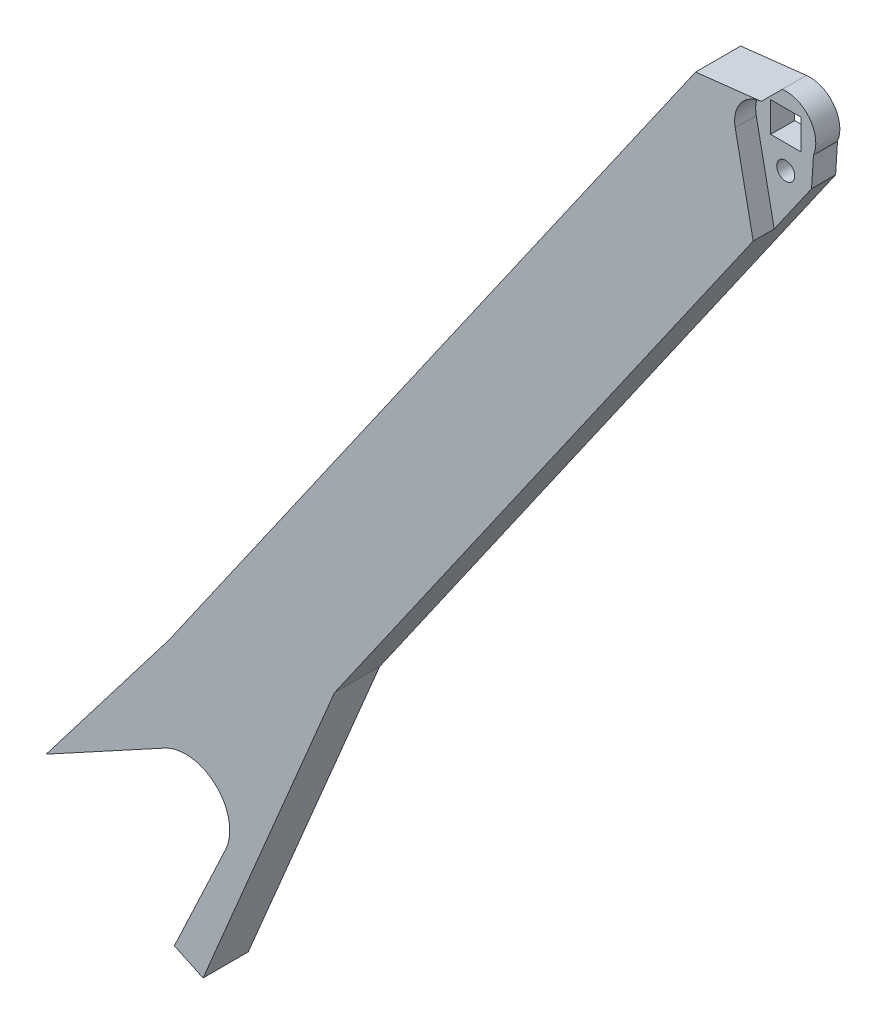
from build123d import *

# Parameters (mm, degrees)
BOSS_EXTRUDE1_DEPTH = 9.525
CUT_EXTRUDE1_START  = -4.445
CUT_EXTRUDE1_DEPTH  = 4.445
SKETCH3_R           = 1.905
SKETCH3_W           = 6.35
SKETCH3_H           = 6.35
CUT_EXTRUDE2_DEPTH  = 252.056346263


with BuildPart() as part:
    # Sketch1 → Boss-Extrude1 (new body)
    with BuildSketch(Plane.XY):
        with BuildLine():
            Line((37.887154169, 1.47019733), (27.071909447, -21.512197706))
            Line((27.071909447, -21.512197706), (33.138342598, -24.366989778))
            Line((33.138342598, -24.366989778), (60.90777145, 41.722489626))
            Line((60.90777145, 41.722489626), (157.204972785, 179.808197732))
            Line((157.204972785, 179.808197732), (157.605048009, 186.145582036))
            ThreePointArc((157.605048009, 186.145582036), (156.833701368, 192.411577396), (151.038083589, 194.915272276))
            Line((151.038083589, 194.915272276), (137.156365398, 193.347216127))
            Line((137.156365398, 193.347216127), (25.899136681, 33.809524518))
            Line((25.899136681, 33.809524518), (0, 0))
            Line((0, 0), (25.00366663, 13.61700957))
            ThreePointArc((25.00366663, 13.61700957), (35.848848557, 12.214099668), (37.887154169, 1.47019733))
        make_face()
    extrude(amount=BOSS_EXTRUDE1_DEPTH)

    # Sketch2 → Cut-Extrude1 (cut)
    with BuildSketch(Plane.XY.offset(9.525).offset(CUT_EXTRUDE1_START)):
        with BuildLine():
            Line((149.320840168, 168.502718236), (145.525755772, 187.35205629))
            ThreePointArc((145.525755772, 187.35205629), (146.619175628, 192.34552843), (151.038083589, 194.915272276))
            ThreePointArc((151.038083589, 194.915272276), (156.833701368, 192.411577396), (157.605048009, 186.145582036))
            Line((157.605048009, 186.145582036), (157.204972785, 179.808197732))
            Line((157.204972785, 179.808197732), (149.320840168, 168.502718236))
        make_face()
    extrude(amount=CUT_EXTRUDE1_DEPTH, mode=Mode.SUBTRACT)

    # Sketch3 → Cut-Extrude2 (cut, through all)
    with BuildSketch(Plane.XY.offset(5.08)):
        with Locations((151.750836383, 180.350400371)):
            Circle(SKETCH3_R)
        with Locations((151.750836383, 188.605400371)):
            Rectangle(SKETCH3_W, SKETCH3_H)
    extrude(amount=-CUT_EXTRUDE2_DEPTH, mode=Mode.SUBTRACT)


solid = part.part
